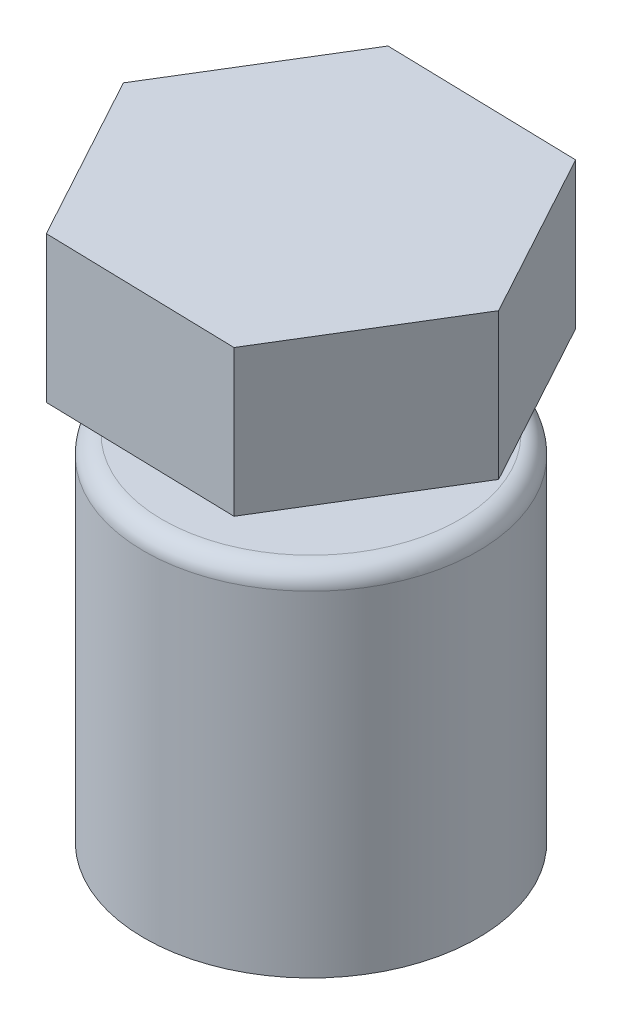
from build123d import *

# Parameters (mm, degrees)
FILLET1_R           = 5
BOSS_EXTRUDE1_DEPTH = 40


with BuildPart() as part:
    # Sketch1 → Revolve1 (revolve)
    with BuildSketch(Plane.XY):
        Polygon((0, 53.644352642), (9.536904547, 53.644352642), (9.536904547, 41.486045656), (13.660971378, 41.486045656), (13.660971378, 27.579696934), (15.444675892, 27.579696934), (15.444675892, 23.71338428), (13.660971378, 23.71338428), (13.660971378, 11.341183786), (45.622489321, 11.341183786), (45.622489321, -85.316632571), (0, -85.316632571), (0, -75.779728024), (40.982914135, -75.779728024), (40.982914135, 5.92834607), (0, 5.92834607), align=None)
    revolve(axis=Axis((0, 5.92834607, 0), (0, 1, 0)))

    # Fillet1
    fillet1_edges = [part.edges().sort_by_distance(p)[0] for p in [
        (-45.622489321, 11.341183786, 0),
    ]]
    fillet(fillet1_edges, radius=FILLET1_R)


with BuildPart() as body_2:
    # Sketch2 → Boss-Extrude1 (new body)
    with BuildSketch(Plane(origin=(0, 27.579696934, 0), x_dir=(1, 0, 0), z_dir=(0, 1, 0))):
        Polygon((52.66378308, -1.319593653), (27.474693167, 44.94837718), (-25.189089914, 46.267970834), (-52.66378308, 1.319593653), (-27.474693167, -44.94837718), (25.189089914, -46.267970834), align=None)
    extrude(amount=BOSS_EXTRUDE1_DEPTH)

    # Sketch1<2> → Cut-Revolve1 (revolve, cut)
    with BuildSketch(Plane.XY):
        Polygon((0, 53.644352642), (9.536904547, 53.644352642), (9.536904547, 41.486045656), (13.660971378, 41.486045656), (13.660971378, 27.579696934), (15.444675892, 27.579696934), (15.444675892, 23.71338428), (13.660971378, 23.71338428), (13.660971378, 11.341183786), (45.622489321, 11.341183786), (45.622489321, -85.316632571), (0, -85.316632571), (0, -75.779728024), (40.982914135, -75.779728024), (40.982914135, 5.92834607), (0, 5.92834607), align=None)
    revolve(axis=Axis((0, 5.92834607, 0), (0, 1, 0)), mode=Mode.SUBTRACT)


solid = Compound([part.part, body_2.part])
